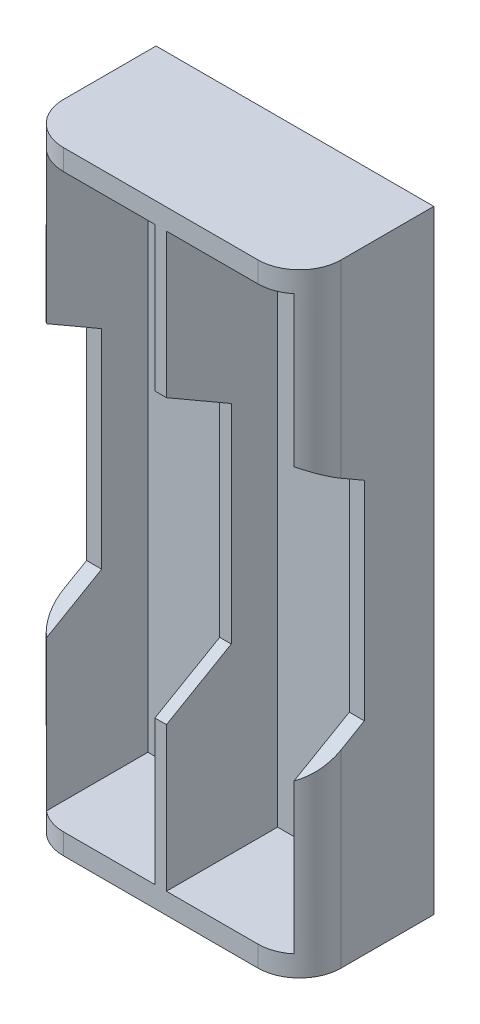
from build123d import *

# Parameters (mm, degrees)
SKETCH1_W               = 24
SKETCH1_H               = 53
BOSS_EXTRUDE1_DEPTH     = 2
BOSS_EXTRUDE2_DEPTH     = 53
SKETCH3_W               = 10.2
SKETCH3_H               = 49.4
CUT_EXTRUDE1_DEPTH      = 9.6
CUT_EXTRUDE2_DEPTH      = 32.317886263
CUT_EXTRUDE2_DEPTH_BACK = 32.317886263


with BuildPart() as part:
    # Sketch1 → Boss-Extrude1 (new body)
    with BuildSketch(Plane.XY):
        Rectangle(SKETCH1_W, SKETCH1_H)
    extrude(amount=BOSS_EXTRUDE1_DEPTH)

    # Sketch2 → Boss-Extrude2 (add)
    with BuildSketch(Plane.XZ.offset(26.5)):
        with BuildLine():
            Line((-8.4, 11.6), (8.4, 11.6))
            ThreePointArc((8.4, 11.6), (10.945584412, 10.545584412), (12, 8))
            Line((12, 8), (12, 2))
            Line((12, 2), (-12, 2))
            Line((-12, 2), (-12, 8))
            ThreePointArc((-12, 8), (-10.945584412, 10.545584412), (-8.4, 11.6))
        make_face()
    extrude(amount=-BOSS_EXTRUDE2_DEPTH)

    # Sketch3 → Cut-Extrude1 (cut)
    with BuildSketch(Plane.XY.offset(11.6)):
        with Locations((5.6, 0)):
            Rectangle(SKETCH3_W, SKETCH3_H)
        with Locations((-5.6, 0)):
            Rectangle(SKETCH3_W, SKETCH3_H)
    extrude(amount=-CUT_EXTRUDE1_DEPTH, mode=Mode.SUBTRACT)

    # Sketch4 → Cut-Extrude2 (cut, two sides: drawn at the far end of the back side and taken through both)
    with BuildSketch(Plane(origin=(0, 0, 0), x_dir=(0, 0, -1), z_dir=(1, 0, 0)).offset(-CUT_EXTRUDE2_DEPTH_BACK)):
        Polygon((-16.6, -15.119912853), (-16.6, 15.119912853), (-6, 9), (-6, -9), align=None)
    extrude(amount=CUT_EXTRUDE2_DEPTH + CUT_EXTRUDE2_DEPTH_BACK, mode=Mode.SUBTRACT)


solid = part.part
